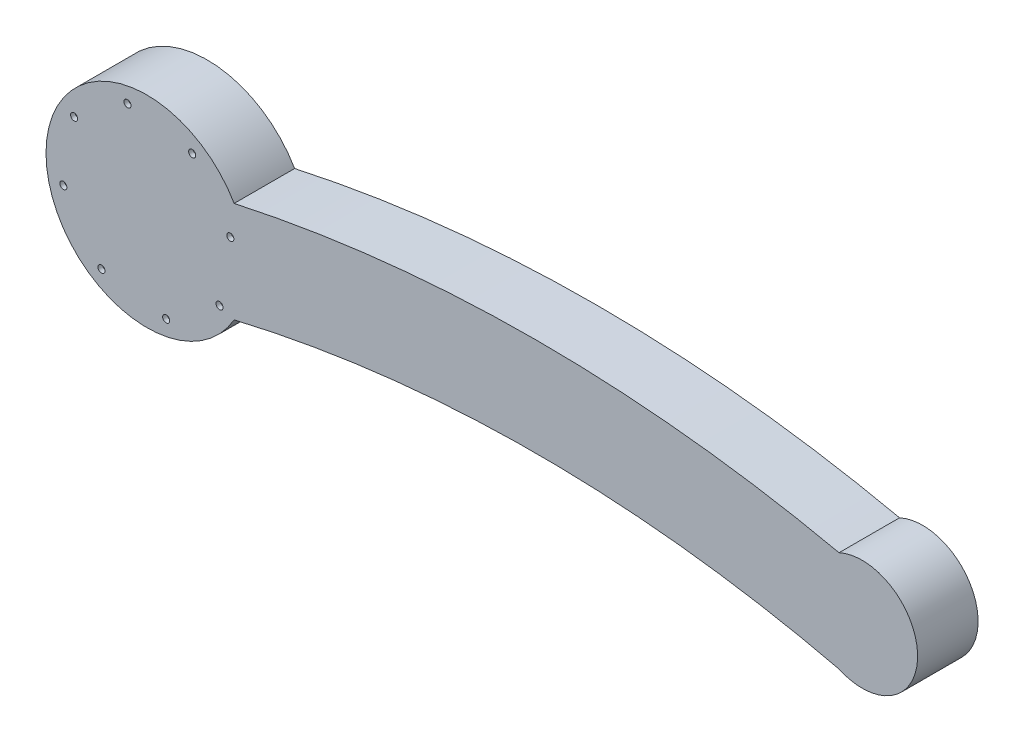
from build123d import *

# Parameters (mm, degrees)
EXTRUDE_3_DEPTH     = 30
CUT_EXTRUDE_1_DEPTH = 27.75
SKETCH_5_R          = 1.75
CUT_EXTRUDE_2_DEPTH = 250.931131666


with BuildPart() as part:
    # 草图1 → 凸台-拉伸3 (new body)
    with BuildSketch(Plane.XY):
        with BuildLine():
            ThreePointArc((188.956439237, 0), (176.309013441, 23.14413618), (150, 25))
            Line((150, 25), (150, -25))
            ThreePointArc((150, -25), (176.309013441, -23.14413618), (188.956439237, 0))
        make_face()
        with BuildLine():
            Line((150, -25), (150, 25))
            ThreePointArc((150, 25), (133.956439237, 0), (150, -25))
        make_face()
        with BuildLine():
            ThreePointArc((188.956439237, 0), (176.309013441, 23.14413618), (150, 25))
            Line((150, 25), (150, -25))
            ThreePointArc((150, -25), (176.309013441, -23.14413618), (188.956439237, 0))
        make_face()
        with BuildLine():
            Line((150, -25), (150, 25))
            ThreePointArc((150, 25), (133.956439237, 0), (150, -25))
        make_face()
        with BuildLine():
            Line((150, 25), (-150, 25))
            ThreePointArc((-150, 25), (-145.004978875, 12.940952255), (-143.301270189, 0))
            ThreePointArc((-143.301270189, 0), (-145.004978875, -12.940952255), (-150, -25))
            ThreePointArc((-150, -25), (0, -7.455532034), (150, -25))
            ThreePointArc((150, -25), (133.956439237, 0), (150, 25))
        make_face()
        with BuildLine():
            ThreePointArc((-150, 25), (0, 41.260283441), (150, 25))
            Line((150, 25), (-150, 25))
        make_face()
        with BuildLine():
            ThreePointArc((-143.301270189, 0), (-145.004978875, 12.940952255), (-150, 25))
            Line((-150, 25), (-150, -25))
            ThreePointArc((-150, -25), (-145.004978875, -12.940952255), (-143.301270189, 0))
        make_face()
        with BuildLine():
            Line((-150, -25), (-150, 25))
            ThreePointArc((-150, 25), (-243.301270189, 0), (-150, -25))
        make_face()
        with BuildLine():
            ThreePointArc((-143.301270189, 0), (-145.004978875, 12.940952255), (-150, 25))
            Line((-150, 25), (-150, -25))
            ThreePointArc((-150, -25), (-145.004978875, -12.940952255), (-143.301270189, 0))
        make_face()
        with BuildLine():
            Line((-150, -25), (-150, 25))
            ThreePointArc((-150, 25), (-243.301270189, 0), (-150, -25))
        make_face()
    extrude(amount=EXTRUDE_3_DEPTH)

    # 草图3 → 切除-拉伸1 (cut)
    with BuildSketch(Plane(origin=(0, 0, 0), x_dir=(-1, 0, 0), z_dir=(0, 0, -1))):
        with BuildLine():
            ThreePointArc((241.460241998, 2.962420354), (203.950254971, 47.06019149), (151.10937756, 23.40740687))
            Line((151.10937756, 23.40740687), (145.115292459, -2.484763599))
            ThreePointArc((145.115292459, -2.484763599), (182.186192507, -46.952290127), (235.258997062, -23.8246019))
            Line((235.258997062, -23.8246019), (238.35961953, -10.431090773))
            Line((238.35961953, -10.431090773), (241.460241998, 2.962420354))
        make_face()
    extrude(amount=-CUT_EXTRUDE_1_DEPTH, mode=Mode.SUBTRACT)

    # 草图5 → 切除-拉伸2 (cut, through all)
    with BuildSketch(Plane(origin=(0, 0, 27.75), x_dir=(-1, 0, 0), z_dir=(0, 0, -1))):
        with Locations((151.896300525, 9.585326657)):
            Circle(SKETCH_5_R)
        with Locations((170.801384844, 36.055584303)):
            Circle(SKETCH_5_R)
        with Locations((202.886596846, 41.404969664)):
            Circle(SKETCH_5_R)
        with Locations((229.356854492, 22.499885346)):
            Circle(SKETCH_5_R)
        with Locations((234.706239853, -9.585326656)):
            Circle(SKETCH_5_R)
        with Locations((215.801155535, -36.055584303)):
            Circle(SKETCH_5_R)
        with Locations((183.715943533, -41.404969664)):
            Circle(SKETCH_5_R)
        with Locations((157.245685886, -22.499885346)):
            Circle(SKETCH_5_R)
    extrude(amount=-CUT_EXTRUDE_2_DEPTH, mode=Mode.SUBTRACT)


solid = part.part
